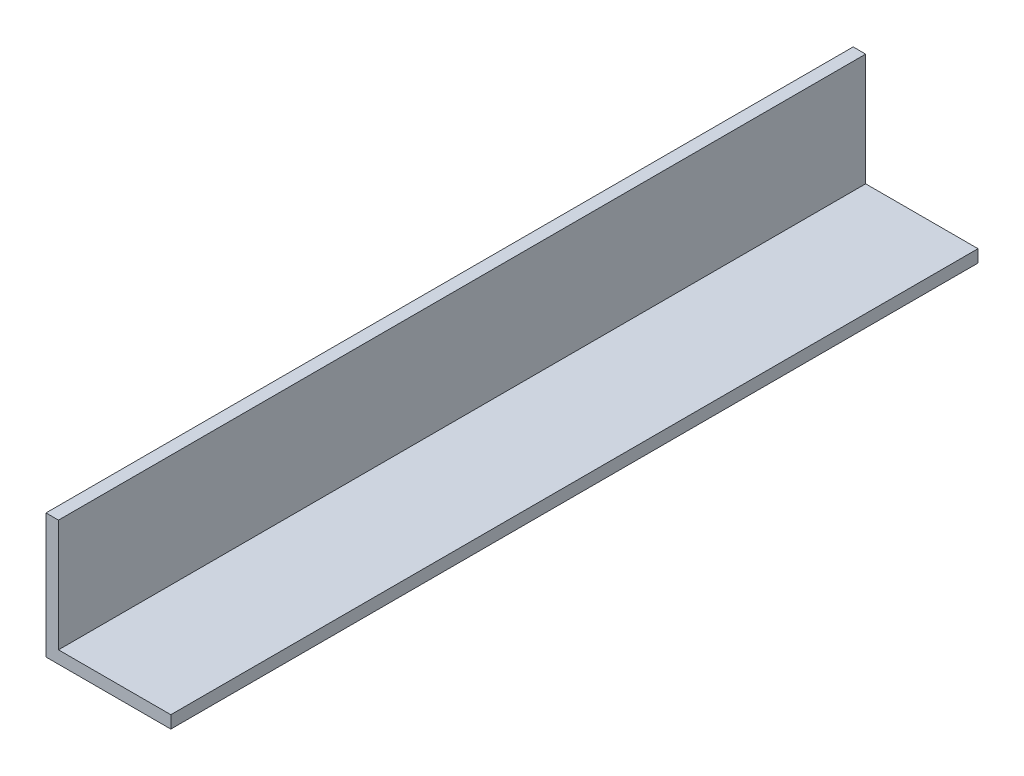
from build123d import *

# Parameters (mm, degrees)
ESTRUSIONE_ESTRUSIONE1_DEPTH = 194


with BuildPart() as part:
    # Schizzo1 → Estrusione-Estrusione1 (new body)
    with BuildSketch(Plane.XY):
        Polygon((0, 0), (30, 0), (30, 3), (3, 3), (3, 30), (0, 30), align=None)
    extrude(amount=ESTRUSIONE_ESTRUSIONE1_DEPTH)


solid = part.part
